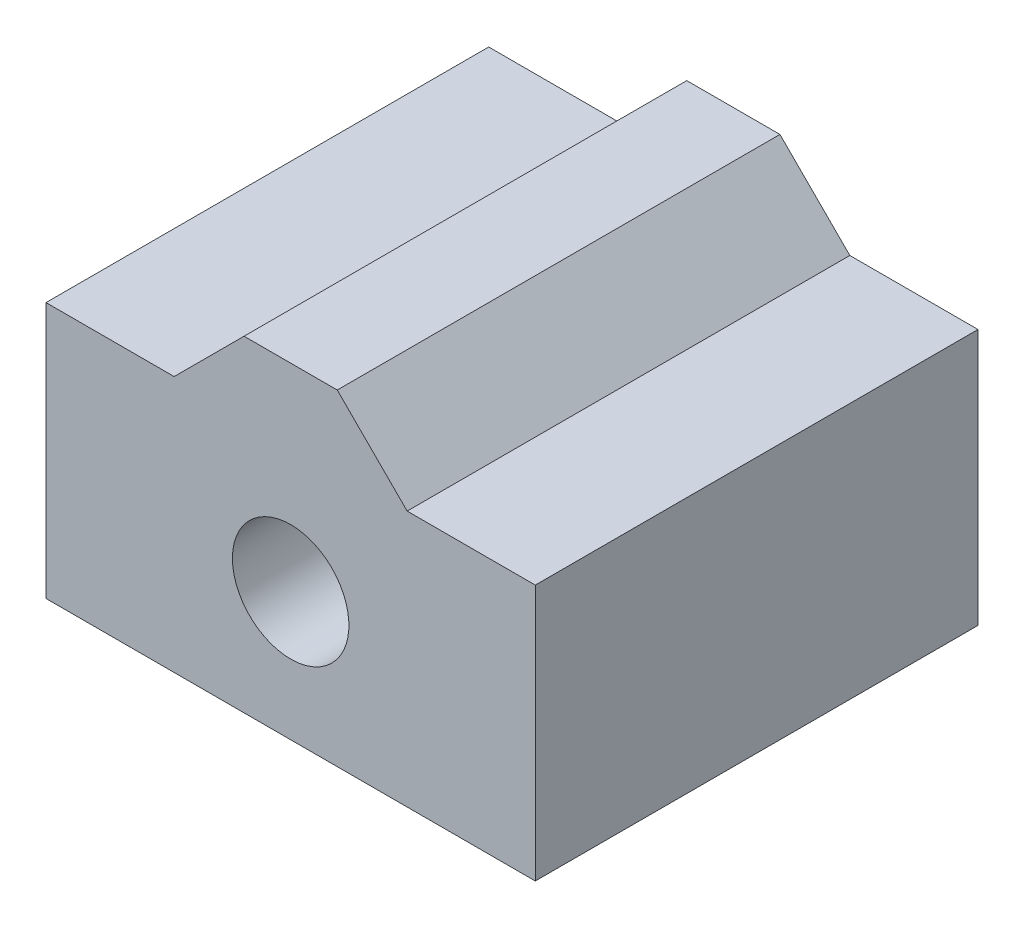
from build123d import *

# Parameters (mm, degrees)
SKETCH1_R           = 3.96875
BOSS_EXTRUDE1_DEPTH = 30.1625


with BuildPart() as part:
    # Sketch1 → Boss-Extrude1 (new body)
    with BuildSketch(Plane.XY):
        Polygon((3.175, 13.49375), (-3.175, 13.49375), (-7.9375, 8.73125), (-16.66875, 8.73125), (-16.66875, -8.73125), (16.66875, -8.73125), (16.66875, 8.73125), (7.9375, 8.73125), align=None)
        with Locations(Location((0, 0, 0), (0, 0, 180))):
            Circle(SKETCH1_R, mode=Mode.SUBTRACT)
    extrude(amount=BOSS_EXTRUDE1_DEPTH)


solid = part.part
